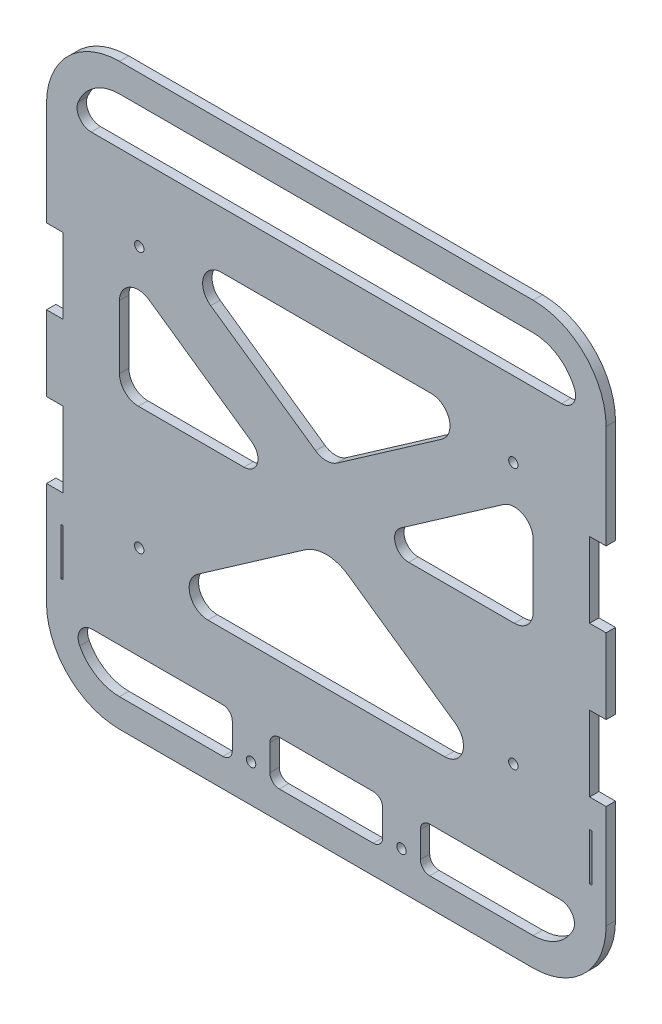
from build123d import *

# Parameters (mm, degrees)
SKETCH1_R           = 1.5875
SKETCH1_W           = 0.7493
SKETCH1_H           = 15.875
BOSS_EXTRUDE1_DEPTH = 3.175


with BuildPart() as part:
    # Sketch1 → Boss-Extrude1 (new body)
    with BuildSketch(Plane.XY.offset(-676.275)):
        with BuildLine():
            Line((94.488, -171.45), (94.488, -136.525))
            Line((94.488, -136.525), (88.9, -136.525))
            Line((88.9, -136.525), (88.9, -111.125))
            Line((88.9, -111.125), (94.488, -111.125))
            Line((94.488, -111.125), (94.488, -85.725))
            Line((94.488, -85.725), (88.9, -85.725))
            Line((88.9, -85.725), (88.9, -60.325))
            Line((88.9, -60.325), (94.488, -60.325))
            Line((94.488, -60.325), (94.488, -25.4))
            ThreePointArc((94.488, -25.4), (87.271696875, -7.978303125), (69.85, -0.762))
            Line((69.85, -0.762), (-69.85, -0.762))
            ThreePointArc((-69.85, -0.762), (-87.271696875, -7.978303125), (-94.488, -25.4))
            Line((-94.488, -25.4), (-94.488, -60.325))
            Line((-94.488, -60.325), (-88.9, -60.325))
            Line((-88.9, -60.325), (-88.9, -85.725))
            Line((-88.9, -85.725), (-94.488, -85.725))
            Line((-94.488, -85.725), (-94.488, -111.125))
            Line((-94.488, -111.125), (-88.9, -111.125))
            Line((-88.9, -111.125), (-88.9, -136.525))
            Line((-88.9, -136.525), (-94.488, -136.525))
            Line((-94.488, -136.525), (-94.488, -171.45))
            ThreePointArc((-94.488, -171.45), (-87.271696875, -188.871696875), (-69.85, -196.088))
            Line((-69.85, -196.088), (69.85, -196.088))
            ThreePointArc((69.85, -196.088), (87.271696875, -188.871696875), (94.488, -171.45))
        make_face()
        with Locations(Location((63.1655201, -139.7, 0), (0, 0, 180))):
            Circle(SKETCH1_R, mode=Mode.SUBTRACT)
        with Locations(Location((-63.1655201, -51.5992872, 0), (0, 0, 180))):
            Circle(SKETCH1_R, mode=Mode.SUBTRACT)
        with Locations(Location((25.4, -183.388, 0), (0, 0, 180))):
            Circle(SKETCH1_R, mode=Mode.SUBTRACT)
        with Locations(Location((-25.4, -183.388, 0), (0, 0, 180))):
            Circle(SKETCH1_R, mode=Mode.SUBTRACT)
        with Locations(Location((-63.1655201, -139.7, 0), (0, 0, 180))):
            Circle(SKETCH1_R, mode=Mode.SUBTRACT)
        with Locations(Location((63.1655201, -51.5992872, 0), (0, 0, 180))):
            Circle(SKETCH1_R, mode=Mode.SUBTRACT)
        with BuildLine():
            Line((7.264641701, -112.328307791), (43.598023874, -137.666473794))
            ThreePointArc((43.598023874, -137.666473794), (46.023616914, -144.778727737), (39.965703023, -149.225))
            Line((39.965703023, -149.225), (-39.965703023, -149.225))
            ThreePointArc((-39.965703023, -149.225), (-46.023616914, -144.778727737), (-43.598023874, -137.666473794))
            Line((-43.598023874, -137.666473794), (-7.264641701, -112.328307791))
            ThreePointArc((-7.264641701, -112.328307791), (0, -110.045360203), (7.264641701, -112.328307791))
        make_face(mode=Mode.SUBTRACT)
        with BuildLine():
            Line((39.04526783, -56.807813406), (3.632320851, -81.504086518))
            ThreePointArc((3.632320851, -81.504086518), (0, -82.645560312), (-3.632320851, -81.504086518))
            Line((-3.632320851, -81.504086518), (-39.04526783, -56.807813406))
            ThreePointArc((-39.04526783, -56.807813406), (-41.47086087, -49.695559463), (-35.41294698, -45.2492872))
            Line((-35.41294698, -45.2492872), (35.41294698, -45.2492872))
            ThreePointArc((35.41294698, -45.2492872), (41.47086087, -49.695559463), (39.04526783, -56.807813406))
        make_face(mode=Mode.SUBTRACT)
        with BuildLine():
            Line((69.85, -70.72011097), (69.85, -92.075))
            ThreePointArc((69.85, -92.075), (67.990128061, -96.565128061), (63.5, -98.425))
            Line((63.5, -98.425), (27.826758339, -98.425))
            ThreePointArc((27.826758339, -98.425), (23.283322921, -95.090295803), (25.102517701, -89.756105345))
            Line((25.102517701, -89.756105345), (59.867679149, -65.511584764))
            ThreePointArc((59.867679149, -65.511584764), (66.4374532, -65.090380186), (69.85, -70.72011097))
        make_face(mode=Mode.SUBTRACT)
        with BuildLine():
            Line((-59.867679149, -65.511584764), (-25.102517701, -89.756105345))
            ThreePointArc((-25.102517701, -89.756105345), (-23.283322921, -95.090295803), (-27.826758339, -98.425))
            Line((-27.826758339, -98.425), (-63.5, -98.425))
            ThreePointArc((-63.5, -98.425), (-67.990128061, -96.565128061), (-69.85, -92.075))
            Line((-69.85, -92.075), (-69.85, -70.72011097))
            ThreePointArc((-69.85, -70.72011097), (-66.4374532, -65.090380186), (-59.867679149, -65.511584764))
        make_face(mode=Mode.SUBTRACT)
        with BuildLine():
            Line((-69.85, -186.563), (-34.925, -186.563))
            ThreePointArc((-34.925, -186.563), (-32.67993597, -185.63306403), (-31.75, -183.388))
            Line((-31.75, -183.388), (-31.75, -174.625))
            ThreePointArc((-31.75, -174.625), (-32.67993597, -172.37993597), (-34.925, -171.45))
            Line((-34.925, -171.45), (-79.039746678, -171.45))
            ThreePointArc((-79.039746678, -171.45), (-83.108999442, -173.738113573), (-83.268157726, -178.403834356))
            ThreePointArc((-83.268157726, -178.403834356), (-77.702052928, -184.363095439), (-69.85, -186.563))
        make_face(mode=Mode.SUBTRACT)
        with BuildLine():
            Line((69.85, -10.287), (-69.85, -10.287))
            ThreePointArc((-69.85, -10.287), (-78.244855824, -12.833012903), (-83.811231367, -19.613223028))
            ThreePointArc((-83.811231367, -19.613223028), (-83.371868677, -24.08222496), (-79.411683667, -26.1992872))
            Line((-79.411683667, -26.1992872), (79.411683667, -26.1992872))
            ThreePointArc((79.411683667, -26.1992872), (83.371868677, -24.08222496), (83.811231367, -19.613223028))
            ThreePointArc((83.811231367, -19.613223028), (78.244855824, -12.833012903), (69.85, -10.287))
        make_face(mode=Mode.SUBTRACT)
        with BuildLine():
            Line((-19.05, -183.388), (-19.05, -174.625))
            ThreePointArc((-19.05, -174.625), (-18.12006403, -172.37993597), (-15.875, -171.45))
            Line((-15.875, -171.45), (15.875, -171.45))
            ThreePointArc((15.875, -171.45), (18.12006403, -172.37993597), (19.05, -174.625))
            Line((19.05, -174.625), (19.05, -183.388))
            ThreePointArc((19.05, -183.388), (18.12006403, -185.63306403), (15.875, -186.563))
            Line((15.875, -186.563), (-15.875, -186.563))
            ThreePointArc((-15.875, -186.563), (-18.12006403, -185.63306403), (-19.05, -183.388))
        make_face(mode=Mode.SUBTRACT)
        with BuildLine():
            Line((31.75, -174.625), (31.75, -183.388))
            ThreePointArc((31.75, -183.388), (32.67993597, -185.63306403), (34.925, -186.563))
            Line((34.925, -186.563), (69.85, -186.563))
            ThreePointArc((69.85, -186.563), (77.702052928, -184.363095439), (83.268157726, -178.403834356))
            ThreePointArc((83.268157726, -178.403834356), (83.108999442, -173.738113573), (79.039746678, -171.45))
            Line((79.039746678, -171.45), (34.925, -171.45))
            ThreePointArc((34.925, -171.45), (32.67993597, -172.37993597), (31.75, -174.625))
        make_face(mode=Mode.SUBTRACT)
        with Locations((-89.27465, -153.9875)):
            Rectangle(SKETCH1_W, SKETCH1_H, mode=Mode.SUBTRACT)
        with Locations((89.27465, -153.9875)):
            Rectangle(SKETCH1_W, SKETCH1_H, mode=Mode.SUBTRACT)
    extrude(amount=-BOSS_EXTRUDE1_DEPTH)


solid = part.part
